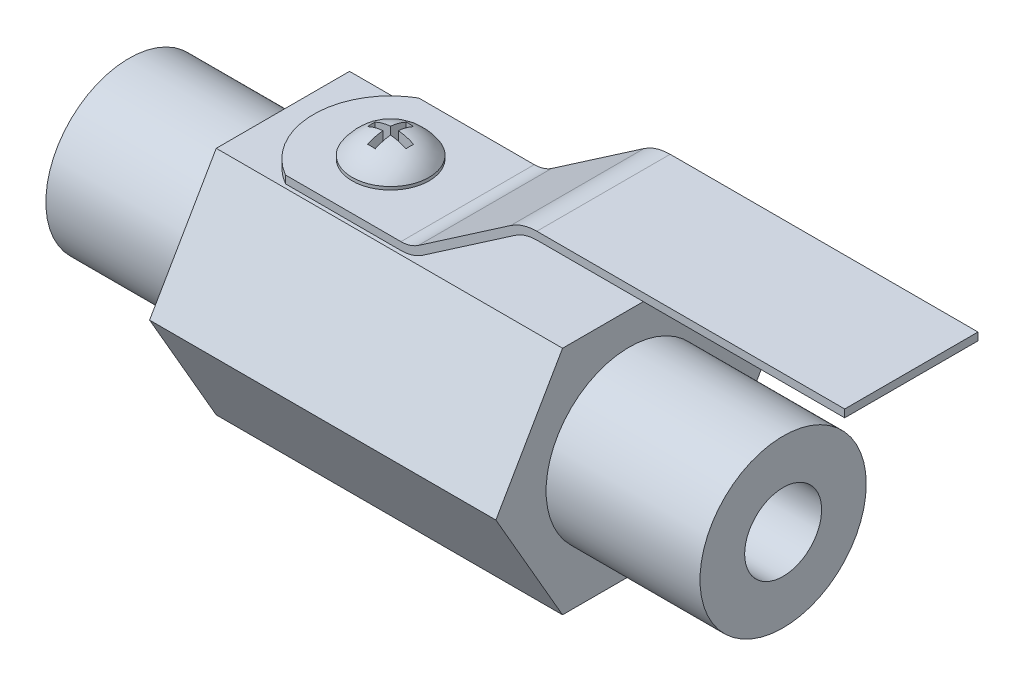
from build123d import *

# Parameters (mm, degrees)
BOSS_EXTRUDE1_DEPTH         = 28.575
BOSS_EXTRUDE2_DEPTH         = 12.7
BOSS_EXTRUDE2_DEPTH_BACK    = 41.275
SKETCH2_R                   = 6.858
F_1_4_0_25_DIAMETER_HOLE1_D = 6.35
BOSS_EXTRUDE3_DEPTH         = 5.499261
BOSS_EXTRUDE3_DEPTH_BACK    = 5.499261
CUT_EXTRUDE2_DEPTH          = 0.635
SKETCH8_R                   = 3.175
BOSS_EXTRUDE4_DEPTH         = 0.254
DOME1_FACE_RADIUS           = 3.175
DOME1_HEIGHT                = 1.778
CUT_EXTRUDE3_REACH          = 59.165
CUT_EXTRUDE3_END_RADIUS     = 3.723821429
CUT_EXTRUDE3_START          = 0.508
BOSS_EXTRUDE5_REACH         = 58.328
SKETCH10_R                  = 1.5875


with BuildPart() as part:
    # Sketch1 → Boss-Extrude1 (new body)
    with BuildSketch(Plane(origin=(0, 0, 0), x_dir=(0, 0, -1), z_dir=(1, 0, 0))):
        Polygon((10.998522628, 0), (5.499261314, 9.525), (-5.499261314, 9.525), (-10.998522628, 0), (-5.499261314, -9.525), (5.499261314, -9.525), align=None)
    extrude(amount=BOSS_EXTRUDE1_DEPTH)

    # Sketch2 → Boss-Extrude2 (add, two sides: drawn at the far end of the back side and taken through both)
    with BuildSketch(Plane(origin=(28.575, 0, 0), x_dir=(0, 0, -1), z_dir=(1, 0, 0)).offset(-BOSS_EXTRUDE2_DEPTH_BACK)):
        Circle(SKETCH2_R)
    extrude(amount=BOSS_EXTRUDE2_DEPTH + BOSS_EXTRUDE2_DEPTH_BACK)

    # 1/4 (0.25) Diameter Hole1 (through all)
    with Locations(Plane.ZY.offset(12.7)):
        with Locations((0, 0)):
            Hole(F_1_4_0_25_DIAMETER_HOLE1_D / 2)


with BuildPart() as body_2:
    # Sketch6 → Boss-Extrude3 (new, two sides: drawn at the far end of the back side and taken through both)
    with BuildSketch(Plane.XY.offset(-BOSS_EXTRUDE3_DEPTH_BACK)):
        with BuildLine():
            Line((2.54, 9.8425), (15.24, 9.8425))
            ThreePointArc((15.24, 9.8425), (16.181122428, 9.98518841), (17.037654453, 10.400428456))
            Line((17.037654453, 10.400428456), (24.657654453, 15.634571544))
            ThreePointArc((24.657654453, 15.634571544), (25.514186479, 16.04981159), (26.455308906, 16.1925))
            Line((26.455308906, 16.1925), (51.855308906, 16.1925))
            Line((51.855308906, 16.1925), (51.855308906, 16.8275))
            Line((51.855308906, 16.8275), (26.455308906, 16.8275))
            ThreePointArc((26.455308906, 16.8275), (25.325961993, 16.656273907), (24.298123563, 16.157985853))
            Line((24.298123563, 16.157985853), (16.678123563, 10.923842765))
            ThreePointArc((16.678123563, 10.923842765), (15.992897942, 10.591650728), (15.24, 10.4775))
            Line((15.24, 10.4775), (2.54, 10.4775))
            Line((2.54, 10.4775), (2.54, 9.8425))
        make_face()
    extrude(amount=BOSS_EXTRUDE3_DEPTH + BOSS_EXTRUDE3_DEPTH_BACK)

    # Sketch7 → Cut-Extrude2 (cut)
    with BuildSketch(Plane(origin=(0, 10.4775, 0), x_dir=(1, 0, 0), z_dir=(0, 1, 0))):
        with BuildLine():
            Line((2.54, 5.499261314), (2.54, 0))
            ThreePointArc((2.54, 0), (3.390738686, 3.175), (5.715, 5.499261314))
            Line((5.715, 5.499261314), (2.54, 5.499261314))
        make_face()
        with BuildLine():
            Line((2.54, 0), (2.54, -5.499261314))
            Line((2.54, -5.499261314), (5.715, -5.499261314))
            ThreePointArc((5.715, -5.499261314), (3.390738686, -3.175), (2.54, 0))
        make_face()
    extrude(amount=-CUT_EXTRUDE2_DEPTH, mode=Mode.SUBTRACT)

    # Sketch8 → Boss-Extrude4 (add)
    with BuildSketch(Plane(origin=(0, 10.4775, 0), x_dir=(1, 0, 0), z_dir=(0, 1, 0))):
        with Locations(Location((8.89, 0, 0), (0, 0, 270))):
            Circle(SKETCH8_R)
    extrude(amount=BOSS_EXTRUDE4_DEPTH)

    # Dome1: a dome of height H over a round flat face of radius A is a cap of a sphere of radius (A * A + H * H) / (2 * H)
    dome1_r = (DOME1_FACE_RADIUS * DOME1_FACE_RADIUS + DOME1_HEIGHT * DOME1_HEIGHT) / (2 * DOME1_HEIGHT)
    dome1_base = Plane((8.89, 10.7315, 0), z_dir=(0, 1, 0))
    with Locations(dome1_base.offset(DOME1_HEIGHT - dome1_r)):
        dome1_ball = Sphere(dome1_r, mode=Mode.PRIVATE)
    add(split(dome1_ball, bisect_by=dome1_base, keep=Keep.TOP, mode=Mode.PRIVATE))

    # Cut-Extrude3: up to this sphere (the profile starts inside it)
    cut_extrude3_end = Location((8.89, 8.785678571, 0)) * Sphere(CUT_EXTRUDE3_END_RADIUS, mode=Mode.PRIVATE)
    # Sketch9 → Cut-Extrude3 (cut, up to the surface)
    with BuildSketch(Plane(origin=(0, 10.4775, 0), x_dir=(1, 0, 0), z_dir=(0, 1, 0)).offset(CUT_EXTRUDE3_START), mode=Mode.PRIVATE) as cut_extrude3_sk1:
        Polygon((8.5725, 1.5875), (9.2075, 1.5875), (9.2075, 0.3175), (10.4775, 0.3175), (10.4775, -0.3175), (9.2075, -0.3175), (9.2075, -1.5875), (8.5725, -1.5875), (8.5725, -0.3175), (7.3025, -0.3175), (7.3025, 0.3175), (8.5725, 0.3175), align=None)
    cut_extrude3_tool1 = extrude(cut_extrude3_sk1.sketch, amount=CUT_EXTRUDE3_REACH, mode=Mode.PRIVATE) & cut_extrude3_end
    add(cut_extrude3_tool1.solids().sort_by_distance((8.89, 10.9855, 0))[0], mode=Mode.SUBTRACT)

    # Sketch10 → Boss-Extrude5 (add, up to next)
    with BuildSketch(Plane(origin=(0, 9.525, 0), x_dir=(1, 0, 0), z_dir=(0, 1, 0)), mode=Mode.PRIVATE) as boss_extrude5_sk1:
        with Locations(Location((8.89, 0, 0), (0, 0, 90))):
            Circle(SKETCH10_R)
    boss_extrude5_tool1 = extrude(boss_extrude5_sk1.sketch, amount=BOSS_EXTRUDE5_REACH, mode=Mode.PRIVATE) - body_2.part

    add(part.part)  # Boss-Extrude5 merges part
    add(boss_extrude5_tool1.solids().sort_by_distance((8.89, 9.525, 0))[0])


solid = body_2.part
